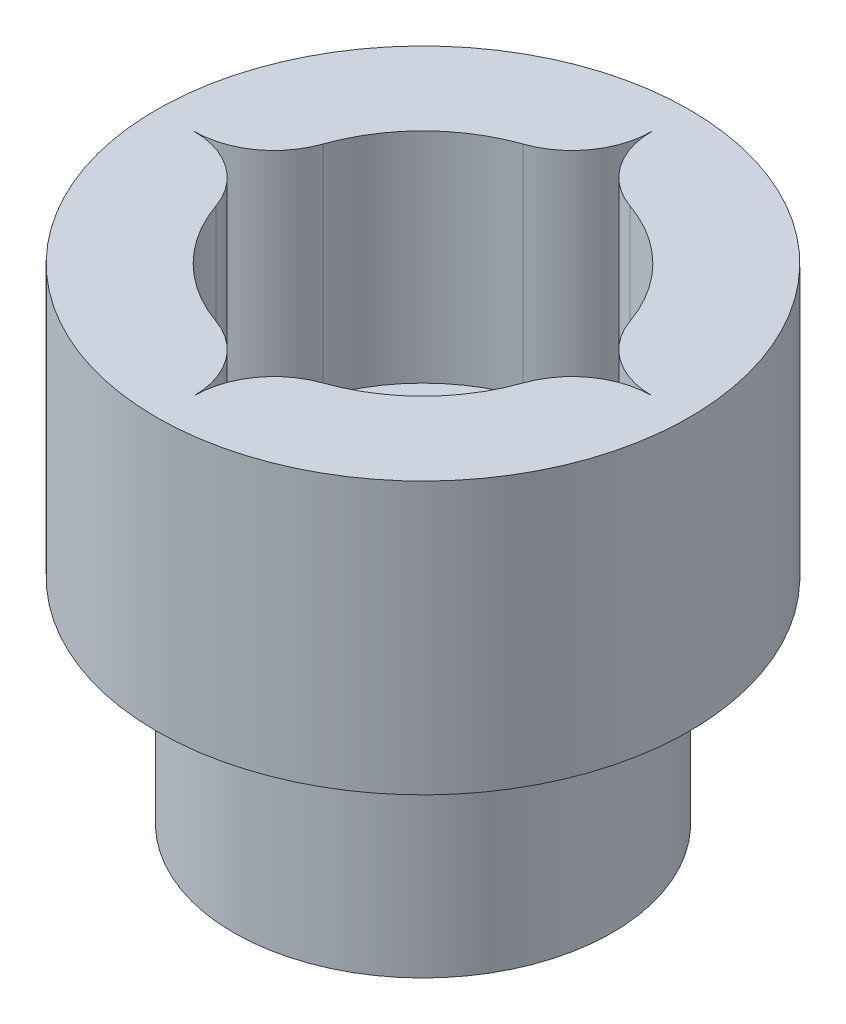
from build123d import *

# Parameters (mm, degrees)
SKETCH1_R           = 3.551074582
BOSS_EXTRUDE1_DEPTH = 4
SKETCH2_R           = 5
BOSS_EXTRUDE2_DEPTH = 1
SKETCH3_R           = 5
BOSS_EXTRUDE3_DEPTH = 4.1


with BuildPart() as part:
    # Sketch1 → Boss-Extrude1 (new body)
    with BuildSketch(Plane(origin=(0, 0, 0), x_dir=(1, 0, 0), z_dir=(0, 1, 0))):
        with Locations(Location((0, 0, 0), (0, 0, 270))):
            Circle(SKETCH1_R)
        with BuildLine():
            ThreePointArc((-0.825, -1.428941916), (-1.166726189, -1.166726189), (-1.428941916, -0.825))
            ThreePointArc((-1.428941916, -0.825), (-1.997567148, -0.207840905), (-2.801592181, 0.0325))
            ThreePointArc((-2.801592181, 0.0325), (-2.009092181, 0.244849735), (-1.428941916, 0.825))
            ThreePointArc((-1.428941916, 0.825), (-1.159961762, 1.173451623), (-0.808423493, 1.438385017))
            ThreePointArc((-0.808423493, 1.438385017), (-0.216954174, 2.019684231), (0, 2.820106381))
            ThreePointArc((0, 2.820106381), (0.216954174, 2.019684231), (0.808423493, 1.438385017))
            ThreePointArc((0.808423493, 1.438385017), (1.159961762, 1.173451623), (1.428941916, 0.825))
            ThreePointArc((1.428941916, 0.825), (2.009092181, 0.244849735), (2.801592181, 0.0325))
            ThreePointArc((2.801592181, 0.0325), (2.03004847, -0.188087258), (1.465428549, -0.758300183))
            ThreePointArc((1.465428549, -0.758300183), (1.44756945, -0.791860269), (1.428941916, -0.825))
            ThreePointArc((1.428941916, -0.825), (1.418202031, -0.843328524), (1.407227066, -0.861517258))
            ThreePointArc((1.407227066, -0.861517258), (1.151608486, -1.181650497), (0.825, -1.428941916))
            ThreePointArc((0.825, -1.428941916), (0.244849735, -2.009092181), (0.0325, -2.801592181))
            ThreePointArc((0.0325, -2.801592181), (-0.207840905, -1.997567148), (-0.825, -1.428941916))
        make_face(mode=Mode.SUBTRACT)
    extrude(amount=BOSS_EXTRUDE1_DEPTH)

    # Sketch2 → Boss-Extrude2 (add)
    with BuildSketch(Plane(origin=(0, 4, 0), x_dir=(1, 0, 0), z_dir=(0, 1, 0))):
        with Locations(Location((0, 0, 0), (0, 0, 270))):
            Circle(SKETCH2_R)
    extrude(amount=BOSS_EXTRUDE2_DEPTH)

    # Sketch3 → Boss-Extrude3 (add)
    with BuildSketch(Plane(origin=(0, 5, 0), x_dir=(1, 0, 0), z_dir=(0, 1, 0))):
        with Locations(Location((0, 0, 0), (0, 0, 270))):
            Circle(SKETCH3_R)
        with BuildLine():
            ThreePointArc((-1.003793736, 2.880086481), (-2.156675683, 2.156675683), (-2.880086481, 1.003793736))
            ThreePointArc((-2.880086481, 1.003793736), (-3.426379172, 0.276496236), (-4.292951263, 0))
            ThreePointArc((-4.292951263, 0), (-3.426379172, -0.276496236), (-2.880086481, -1.003793736))
            ThreePointArc((-2.880086481, -1.003793736), (-2.156675683, -2.156675683), (-1.003793736, -2.880086481))
            ThreePointArc((-1.003793736, -2.880086481), (-0.276496236, -3.426379172), (0, -4.292951263))
            ThreePointArc((0, -4.292951263), (0.276496236, -3.426379172), (1.003793736, -2.880086481))
            ThreePointArc((1.003793736, -2.880086481), (2.156675683, -2.156675683), (2.880086481, -1.003793736))
            ThreePointArc((2.880086481, -1.003793736), (3.426379172, -0.276496236), (4.292951263, 0))
            ThreePointArc((4.292951263, 0), (3.426379172, 0.276496236), (2.880086481, 1.003793736))
            ThreePointArc((2.880086481, 1.003793736), (2.156675683, 2.156675683), (1.003793736, 2.880086481))
            ThreePointArc((1.003793736, 2.880086481), (0.276496236, 3.426379172), (0, 4.292951263))
            ThreePointArc((0, 4.292951263), (-0.276496236, 3.426379172), (-1.003793736, 2.880086481))
        make_face(mode=Mode.SUBTRACT)
    extrude(amount=BOSS_EXTRUDE3_DEPTH)


solid = part.part
